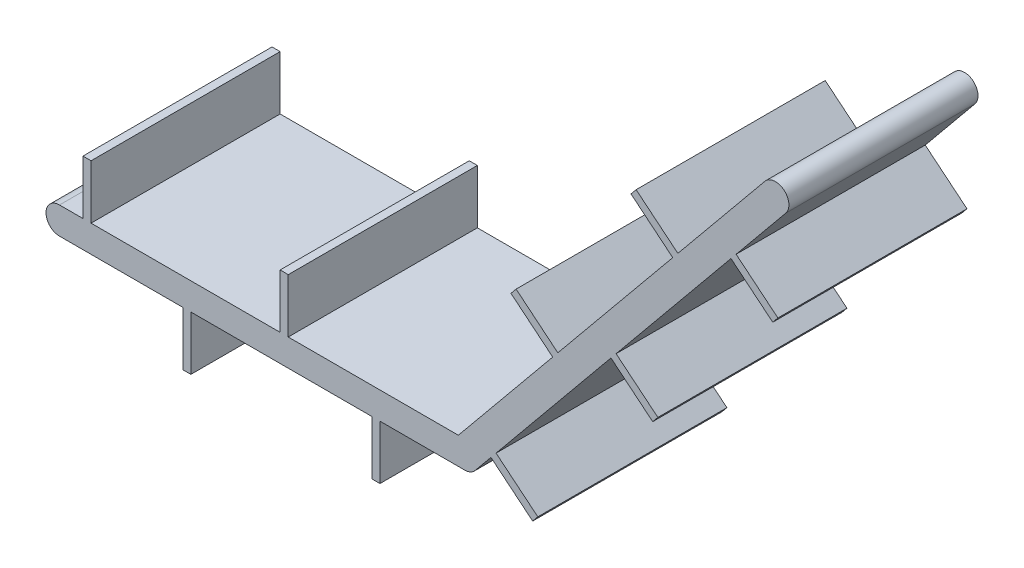
from build123d import *

# Parameters (mm, degrees)
BOSS_EXTRUDE1_DEPTH = 70
SKETCH2_W           = 3
SKETCH2_H           = 70
BOSS_EXTRUDE2_DEPTH = 20
LPATTERN2_COUNT     = 2
LPATTERN2_PITCH     = 73
SKETCH3_W           = 70
SKETCH3_H           = 3
BOSS_EXTRUDE3_DEPTH = 20
LPATTERN3_COUNT     = 2
LPATTERN3_PITCH     = 70
SKETCH6_W           = 3
SKETCH6_H           = 70
BOSS_EXTRUDE4_DEPTH = 20
LPATTERN4_COUNT     = 2
LPATTERN4_PITCH     = 70
SKETCH8_W           = 70
SKETCH8_H           = 3
BOSS_EXTRUDE5_DEPTH = 20
LPATTERN5_COUNT     = 3
LPATTERN5_PITCH     = 70


with BuildPart() as part:
    # Sketch1 → Boss-Extrude1 (new body)
    with BuildSketch(Plane.XY):
        with BuildLine():
            Line((150, -5), (0, -5))
            ThreePointArc((0, -5), (-5, 0), (0, 5))
            Line((0, 5), (147.636546096, 5))
            Line((147.636546096, 5), (261.136368727, 143.173697117))
            ThreePointArc((261.136368727, 143.173697117), (268.173697117, 143.863631273), (268.863631273, 136.826302883))
            Line((268.863631273, 136.826302883), (153.863631273, -3.173697117))
            ThreePointArc((153.863631273, -3.173697117), (152.136763255, -4.520425068), (150, -5))
        make_face()
    extrude(amount=BOSS_EXTRUDE1_DEPTH)

    # Sketch2 → Boss-Extrude2 (add)
    with BuildSketch(Plane(origin=(0, 5, 0), x_dir=(1, 0, 0), z_dir=(0, 1, 0))):
        with Locations((10.170720814, -35)):
            Rectangle(SKETCH2_W, SKETCH2_H)
    boss_extrude2 = extrude(amount=BOSS_EXTRUDE2_DEPTH)

    # LPattern2: Boss-Extrude2 ×2
    with Locations(*[(i * LPATTERN2_PITCH, 0, 0) for i in range(1, LPATTERN2_COUNT)]):
        add(boss_extrude2)

    # Sketch3 → Boss-Extrude3 (add)
    with BuildSketch(Plane(origin=(85.702248392, -70.398275465, 0), x_dir=(0, 0, 1), z_dir=(-0.7727262545252344, 0.6347394233600138, 0))):
        with Locations((35, 154.104367408)):
            Rectangle(SKETCH3_W, SKETCH3_H)
    boss_extrude3 = extrude(amount=BOSS_EXTRUDE3_DEPTH)

    # LPattern3: Boss-Extrude3 ×2
    with Locations(*[Vector(0.6347394233600139, 0.7727262545252342, 0) * (i * LPATTERN3_PITCH) for i in range(1, LPATTERN3_COUNT)]):
        add(boss_extrude3)

    # Sketch6 → Boss-Extrude4 (add)
    with BuildSketch(Plane.XZ.offset(5)):
        with Locations((47.13, 35)):
            Rectangle(SKETCH6_W, SKETCH6_H)
    boss_extrude4 = extrude(amount=BOSS_EXTRUDE4_DEPTH)

    # LPattern4: Boss-Extrude4 ×2
    with Locations(*[(i * LPATTERN4_PITCH, 0, 0) for i in range(1, LPATTERN4_COUNT)]):
        add(boss_extrude4)

    # Sketch8 → Boss-Extrude5 (add)
    with BuildSketch(Plane(origin=(93.429510938, -76.745669699, 0), x_dir=(0, 0, -1), z_dir=(0.7727262545252342, -0.6347394233600141, 0))):
        with Locations((-35, 105.900913504)):
            Rectangle(SKETCH8_W, SKETCH8_H)
    boss_extrude5 = extrude(amount=BOSS_EXTRUDE5_DEPTH)

    # LPattern5: Boss-Extrude5 ×3
    with Locations(*[Vector(0.6347394233600141, 0.7727262545252341, 0) * (i * LPATTERN5_PITCH) for i in range(1, LPATTERN5_COUNT)]):
        add(boss_extrude5)


solid = part.part
